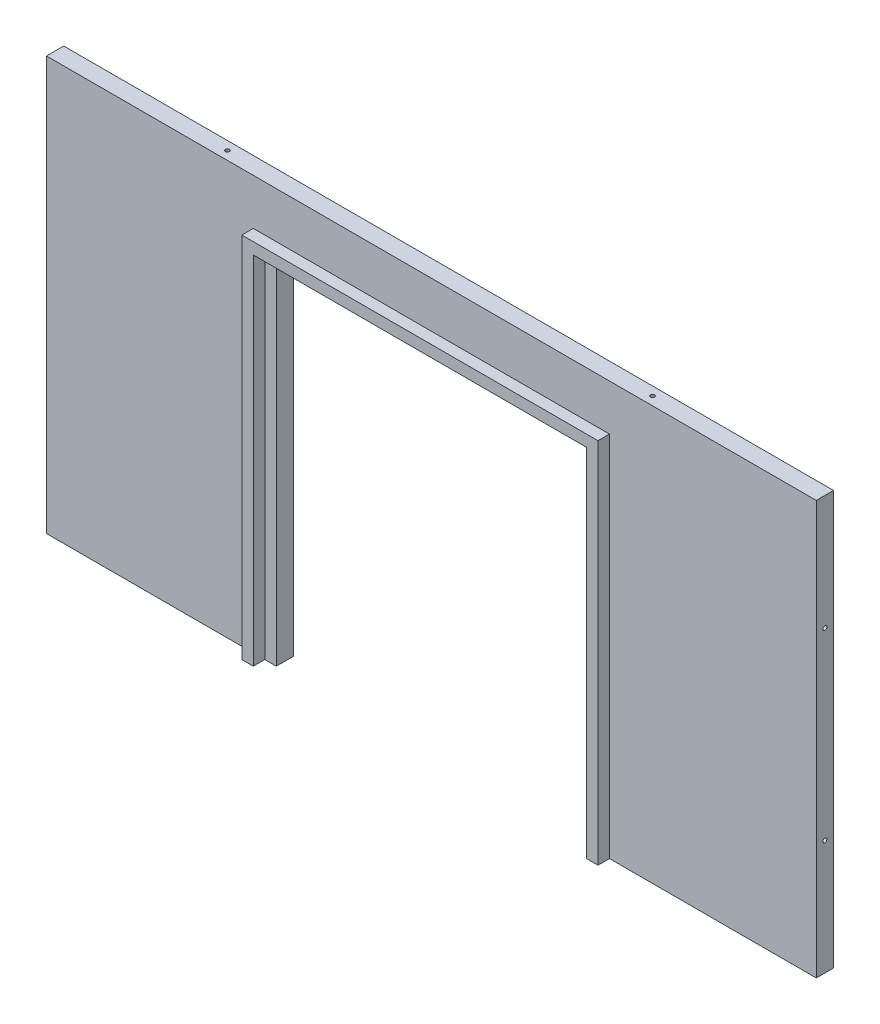
from build123d import *

# Parameters (mm, degrees)
SKETCH_1_W          = 134
SKETCH_1_H          = 72
EXTRUDE_1_DEPTH     = 3
SKETCH_2_W          = 58
SKETCH_2_H          = 62
CUT_EXTRUDE_1_DEPTH = 77.118328936
SKETCH_2_4_W        = 58
SKETCH_2_4_H        = 2
EXTRUDE_2_DEPTH     = 2
EXTRUDE_3_DEPTH     = 3
SKETCH_3_W          = 54
SKETCH_3_H          = 1.5
CUT_EXTRUDE_2_DEPTH = 3
SKETCH_4_R          = 0.35
CUT_EXTRUDE_3_DEPTH = 1.5
CUT_EXTRUDE_START   = -70.5
SKETCH_4_3_R        = 0.35
CUT_EXTRUDE_4_DEPTH = 1.5
SKETCH_5_R          = 0.35
CUT_EXTRUDE_5_DEPTH = 1.5
CUT_EXTRUDE_START_2 = -132.5
SKETCH_5_3_R        = 0.35
CUT_EXTRUDE_6_DEPTH = 1.5


with BuildPart() as part:
    # 草图1 → 凸台-拉伸1 (new body)
    with BuildSketch(Plane.XY):
        Rectangle(SKETCH_1_W, SKETCH_1_H)
    extrude(amount=EXTRUDE_1_DEPTH)

    # 草图2 → 切除-拉伸1 (cut, through all)
    with BuildSketch(Plane.XY.offset(3)):
        with Locations((0, -5)):
            Rectangle(SKETCH_2_W, SKETCH_2_H)
    extrude(amount=-CUT_EXTRUDE_1_DEPTH, mode=Mode.SUBTRACT)

    # 草图2<4> → 凸台-拉伸2 (add)
    with BuildSketch(Plane.XY.offset(3)):
        Polygon((-29, -36), (-29, 26), (-29, 28), (-31, 28), (-31, -36), align=None)
        with Locations((0, 27)):
            Rectangle(SKETCH_2_4_W, SKETCH_2_4_H)
        Polygon((29, 28), (29, 26), (29, -36), (31, -36), (31, 28), align=None)
    extrude(amount=EXTRUDE_2_DEPTH)

    # 草图2<5> → 凸台-拉伸3 (add)
    with BuildSketch(Plane.XY.offset(3)):
        Polygon((29, 26), (-29, 26), (-29, -36), (-27, -36), (-27, 24), (27, 24), (27, -36), (29, -36), align=None)
    extrude(amount=-EXTRUDE_3_DEPTH)

    # 草图3 → 切除-拉伸2 (cut)
    with BuildSketch(Plane.XZ.offset(-24)):
        with Locations((0, 2.25)):
            Rectangle(SKETCH_3_W, SKETCH_3_H)
    extrude(amount=-CUT_EXTRUDE_2_DEPTH, mode=Mode.SUBTRACT)

    # 草图4 → 切除-拉伸3 (cut)
    with BuildSketch(Plane.XZ.offset(36)):
        with Locations(Location((-37, 1.5, 0), (0, 0, 270))):
            Circle(SKETCH_4_R)
        with Locations(Location((37, 1.5, 0), (0, 0, 270))):
            Circle(SKETCH_4_R)
    extrude(amount=-CUT_EXTRUDE_3_DEPTH, mode=Mode.SUBTRACT)

    # 草图4<3> → 切除-拉伸4 (cut)
    with BuildSketch(Plane.XZ.offset(36).offset(CUT_EXTRUDE_START)):
        with Locations(Location((-37, 1.5, 0), (0, 0, 270))):
            Circle(SKETCH_4_3_R)
        with Locations(Location((37, 1.5, 0), (0, 0, 270))):
            Circle(SKETCH_4_3_R)
    extrude(amount=-CUT_EXTRUDE_4_DEPTH, mode=Mode.SUBTRACT)

    # 草图5 → 切除-拉伸5 (cut)
    with BuildSketch(Plane(origin=(67, 0, 0), x_dir=(0, 0, -1), z_dir=(1, 0, 0))):
        with Locations((-1.5, 16)):
            Circle(SKETCH_5_R)
        with Locations((-1.5, -16)):
            Circle(SKETCH_5_R)
    extrude(amount=-CUT_EXTRUDE_5_DEPTH, mode=Mode.SUBTRACT)

    # 草图5<3> → 切除-拉伸6 (cut)
    with BuildSketch(Plane(origin=(67, 0, 0), x_dir=(0, 0, -1), z_dir=(1, 0, 0)).offset(CUT_EXTRUDE_START_2)):
        with Locations((-1.5, 16)):
            Circle(SKETCH_5_3_R)
        with Locations((-1.5, -16)):
            Circle(SKETCH_5_3_R)
    extrude(amount=-CUT_EXTRUDE_6_DEPTH, mode=Mode.SUBTRACT)


solid = part.part
